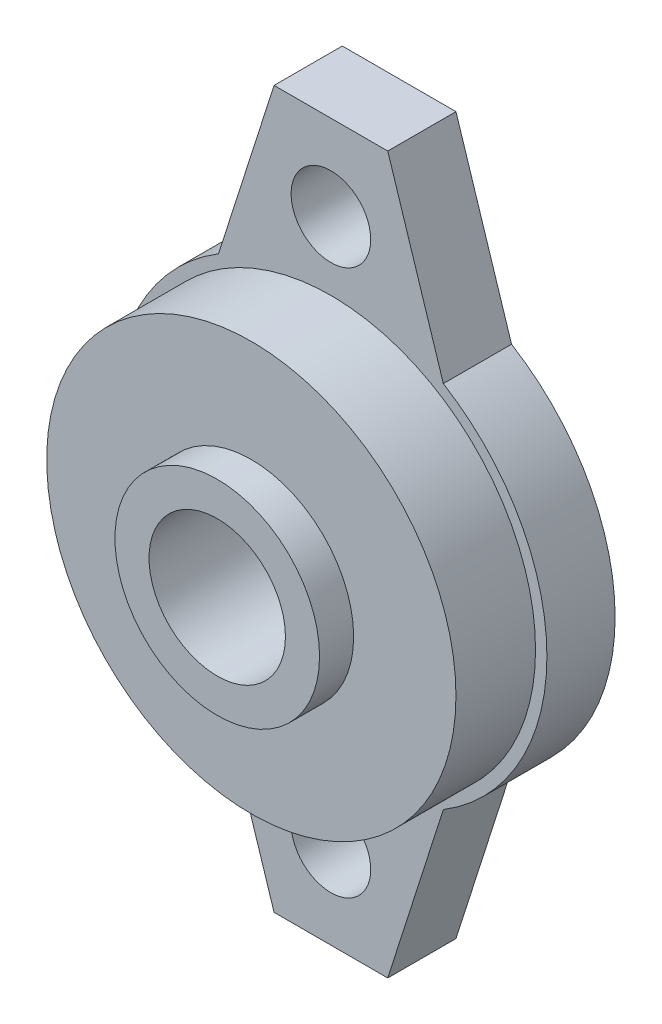
from build123d import *

# Parameters (mm, degrees)
SKETCH_1_R          = 3.5
SKETCH_1_R_2        = 6
EXTRUDE_1_DEPTH     = 6
SKETCH_2_R          = 18
EXTRUDE_2_DEPTH     = 7
SKETCH_3_R          = 9
EXTRUDE_3_DEPTH     = 3
SKETCH_4_R          = 6
CUT_EXTRUDE_1_DEPTH = 41.115458367


with BuildPart() as part:
    # 草圖1 → 填料-伸長1 (new body)
    with BuildSketch(Plane.XY):
        with BuildLine():
            Line((-5, 31.5), (5, 31.5))
            Line((5, 31.5), (9.888283839, 16.224113002))
            ThreePointArc((9.888283839, 16.224113002), (19, 0), (9.888283839, -16.224113002))
            Line((9.888283839, -16.224113002), (5, -31.5))
            Line((5, -31.5), (-5, -31.5))
            Line((-5, -31.5), (-9.888283839, -16.224113002))
            ThreePointArc((-9.888283839, -16.224113002), (-19, 0), (-9.888283839, 16.224113002))
            Line((-9.888283839, 16.224113002), (-5, 31.5))
        make_face()
        with Locations((0, 24)):
            Circle(SKETCH_1_R, mode=Mode.SUBTRACT)
        with Locations((0, -24)):
            Circle(SKETCH_1_R, mode=Mode.SUBTRACT)
        Circle(SKETCH_1_R_2, mode=Mode.SUBTRACT)
    extrude(amount=EXTRUDE_1_DEPTH)

    # 草圖2 → 填料-伸長2 (add)
    with BuildSketch(Plane.XY.offset(6)):
        Circle(SKETCH_2_R)
    extrude(amount=EXTRUDE_2_DEPTH)

    # 草圖3 → 填料-伸長3 (add)
    with BuildSketch(Plane.XY.offset(13)):
        Circle(SKETCH_3_R)
    extrude(amount=EXTRUDE_3_DEPTH)

    # 草圖4 → 除料-伸長1 (cut, through all)
    with BuildSketch(Plane.XY.offset(16)):
        Circle(SKETCH_4_R)
    extrude(amount=-CUT_EXTRUDE_1_DEPTH, mode=Mode.SUBTRACT)


solid = part.part
